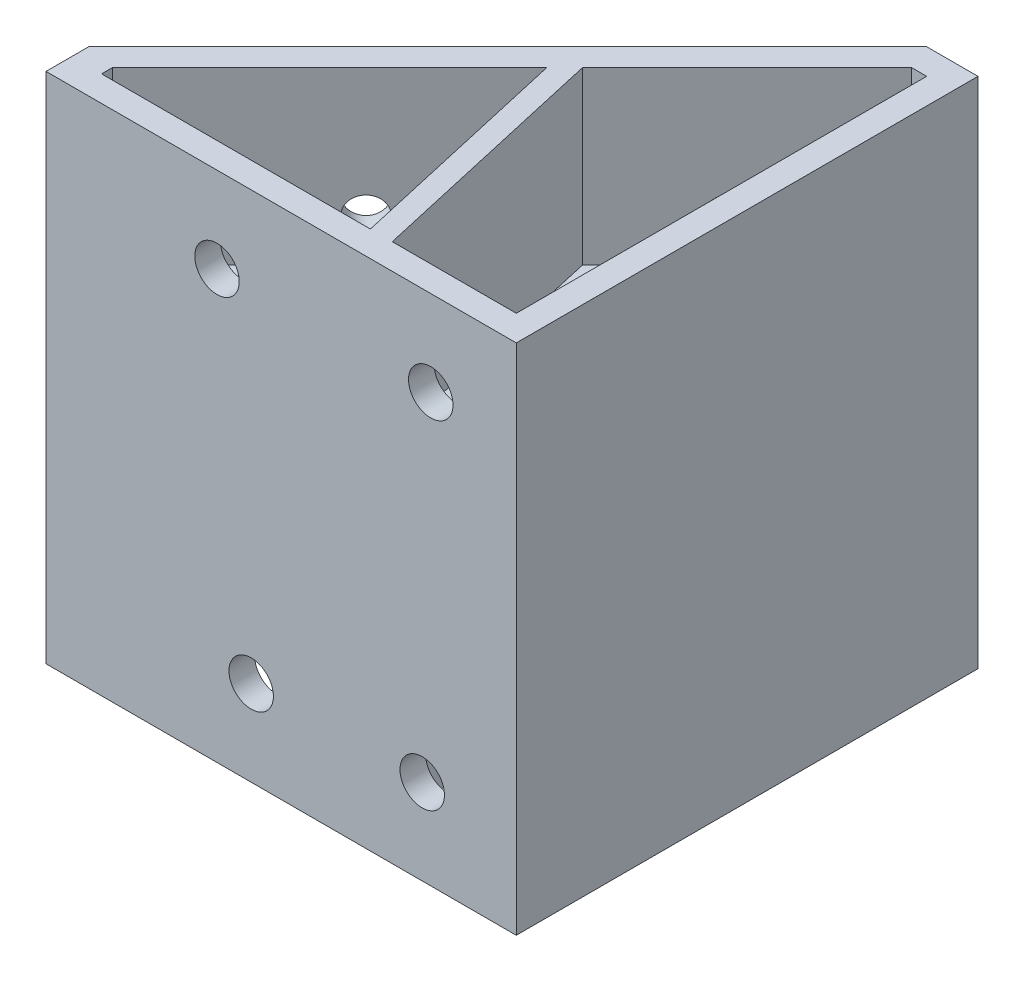
from build123d import *

# Parameters (mm, degrees)
EXTRUDE_1_DEPTH     = 60
SKETCH_3_R          = 2.6
CUT_EXTRUDE_1_DEPTH = 10
SKETCH_4_R          = 2.1
CUT_EXTRUDE_2_DEPTH = 10
EXTRUDE_2_DEPTH     = 3
EXTRUDE_3_DEPTH     = 3
EXTRUDE_4_DEPTH     = 20
EXTRUDE_5_DEPTH     = 20
SKETCH_11_W         = 24
SKETCH_11_H         = 4
SKETCH_11_W_2       = 22.185080678
EXTRUDE_6_DEPTH     = 2


with BuildPart() as part:
    # 草图1 → 凸台-拉伸1 (new body)
    with BuildSketch(Plane(origin=(0, 0, 0), x_dir=(1, 0, 0), z_dir=(0, 1, 0))):
        Polygon((0, 0), (-55, 0), (-55, 5), (-6, 54), (0, 54), align=None)
        Polygon((-4.757359313, 51), (-51.5, 4.257359313), (-51.5, 3), (-3, 3), (-3, 51), align=None, mode=Mode.SUBTRACT)
    extrude(amount=EXTRUDE_1_DEPTH)

    # 草图3 → 切除-拉伸1 (cut)
    with BuildSketch(Plane(origin=(0, 0, -3), x_dir=(-1, 0, 0), z_dir=(0, 0, -1))):
        with Locations((11, 10)):
            Circle(SKETCH_3_R)
        with Locations((31, 10)):
            Circle(SKETCH_3_R)
        with Locations((35, 50)):
            Circle(SKETCH_3_R)
        with Locations((10, 50)):
            Circle(SKETCH_3_R)
    extrude(amount=-CUT_EXTRUDE_1_DEPTH, mode=Mode.SUBTRACT)

    # 草图4 → 切除-拉伸2 (cut)
    with BuildSketch(Plane(origin=(-30, 0, -30), x_dir=(-0.7071067811865511, 0, 0.7071067811865439), z_dir=(-0.7071067811865439, 0, -0.7071067811865511))):
        with Locations((12.426406871, 45)):
            Circle(SKETCH_4_R)
        with Locations((-17.573593129, 45)):
            Circle(SKETCH_4_R)
        with Locations(Location((12.426406871, 15, 0), (0, 0, 180))):
            Circle(SKETCH_4_R)
        with Locations(Location((-17.573593129, 15, 0), (0, 0, 180))):
            Circle(SKETCH_4_R)
    extrude(amount=-CUT_EXTRUDE_2_DEPTH, mode=Mode.SUBTRACT)

    # 草图7 → 凸台-拉伸2 (add)
    with BuildSketch(Plane(origin=(0, 20, 0), x_dir=(-1, 0, 0), z_dir=(0, -1, 0))):
        Polygon((3, 52.757359313), (51.5, 4.257359313), (51.5, 3), (3, 3), align=None)
    extrude(amount=-EXTRUDE_2_DEPTH)

    # 草图8 → 凸台-拉伸3 (add)
    with BuildSketch(Plane(origin=(0, 40, 0), x_dir=(1, 0, 0), z_dir=(0, 1, 0))):
        Polygon((-3, 51), (-4.757359313, 51), (-51.5, 4.257359313), (-51.5, 3), (-3, 3), align=None)
    extrude(amount=-EXTRUDE_3_DEPTH)

    # 草图9 → 凸台-拉伸4 (add)
    with BuildSketch(Plane.XZ):
        Polygon((-20.063260388, -3), (-26.098365074, -29.658994238), (-24.008264838, -31.749094475), (-17.5, -3), align=None)
    extrude(amount=-EXTRUDE_4_DEPTH)

    # 草图10 → 凸台-拉伸5 (add)
    with BuildSketch(Plane(origin=(0, 60, 0), x_dir=(1, 0, 0), z_dir=(0, 1, 0))):
        Polygon((-26.098365074, 29.658994238), (-24.008264838, 31.749094475), (-17.5, 3), (-20.063260388, 3), align=None)
    extrude(amount=-EXTRUDE_5_DEPTH)

    # 草图11 → 凸台-拉伸6 (add)
    with BuildSketch(Plane(origin=(-30, 0, -30), x_dir=(-0.7071067811865511, 0, 0.707106781186544), z_dir=(-0.707106781186544, 0, -0.7071067811865511))):
        with Locations((-2.573593129, 45)):
            Rectangle(SKETCH_11_W, SKETCH_11_H)
        with Locations((-2.702962181, 15)):
            Rectangle(SKETCH_11_W_2, SKETCH_11_H)
    extrude(amount=EXTRUDE_6_DEPTH)


solid = part.part
